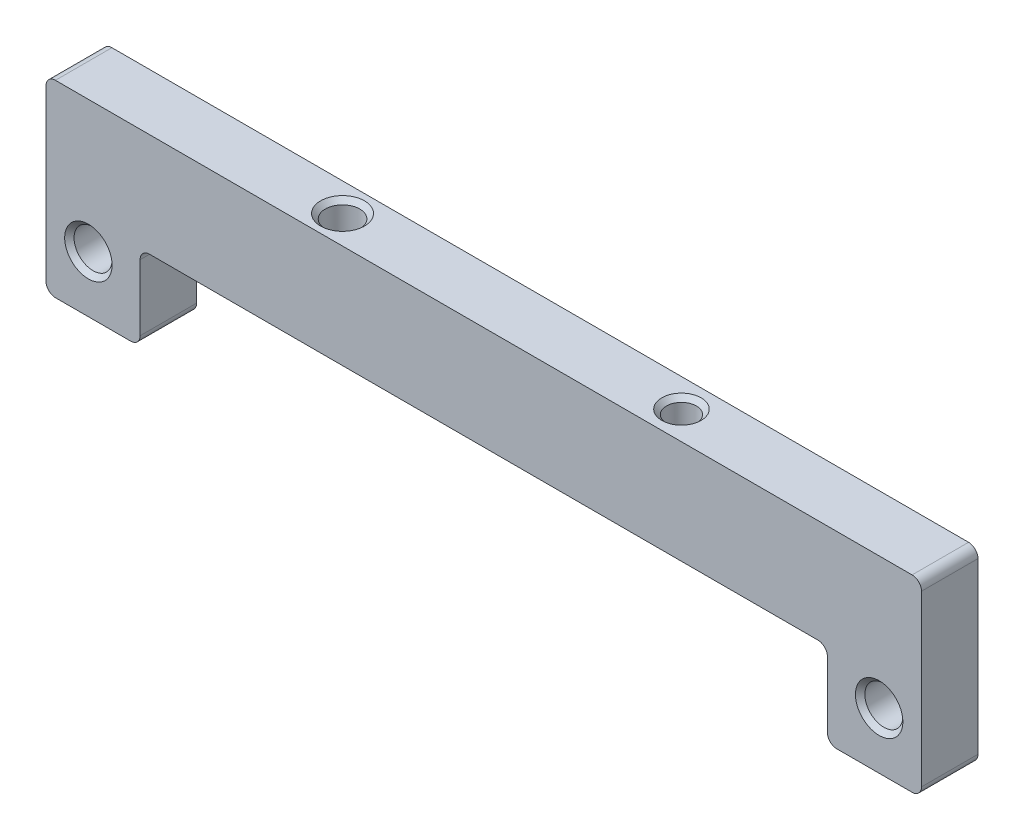
from build123d import *

# Parameters (mm, degrees)
SKETCH1_W                    = 93
SKETCH1_H                    = 20
BOSS_EXTRUDE1_DEPTH          = 6
CUT_EXTRUDE2_REACH           = 49.94
SKETCH3_W                    = 73
SKETCH3_H                    = 9
F_6_CLEARANCE_HOLE1_D        = 3.6576
TAP_DRILL_FOR_10_32_TAP1_D   = 4.0386
F_1_8_0_125_DIAMETER_HOLE1_D = 3.175
FILLET1_R                    = 1
CHAMFER2_SIZE                = 0.5


with BuildPart() as part:
    # Sketch1 → Boss-Extrude1 (new body)
    with BuildSketch(Plane.XY):
        Rectangle(SKETCH1_W, SKETCH1_H)
    extrude(amount=BOSS_EXTRUDE1_DEPTH)

    # Sketch3 → Cut-Extrude2 (cut, up to next)
    with BuildSketch(Plane.XY.offset(6), mode=Mode.PRIVATE) as cut_extrude2_sk1:
        with Locations((0, -5.5)):
            Rectangle(SKETCH3_W, SKETCH3_H)
    cut_extrude2_tool1 = extrude(cut_extrude2_sk1.sketch, amount=-CUT_EXTRUDE2_REACH, mode=Mode.PRIVATE) & part.part
    add(cut_extrude2_tool1.solids().sort_by_distance((0, -5.5, 6))[0], mode=Mode.SUBTRACT)

    # #6 Clearance Hole1 (through all)
    with Locations(Plane(origin=(0, -1, 0), x_dir=(-1, 0, 0), z_dir=(0, -1, 0))):
        with Locations((18, -3)):
            Hole(F_6_CLEARANCE_HOLE1_D / 2)

    # Tap Drill for #10-32 Tap1 (through all)
    with Locations(Plane.XY.offset(6)):
        with Locations((-42, -4), (42, -4)):
            Hole(TAP_DRILL_FOR_10_32_TAP1_D / 2)

    # 1/8 (0.125) Diameter Hole1 (through all)
    with Locations(Plane(origin=(0, -1, 0), x_dir=(-1, 0, 0), z_dir=(0, -1, 0))):
        with Locations((-18, -3)):
            Hole(F_1_8_0_125_DIAMETER_HOLE1_D / 2)

    # Fillet1
    fillet1_edges = [part.edges().sort_by_distance(p)[0] for p in [
        (-36.5, -10, 3),
        (-36.5, -1, 3),
        (36.5, -1, 3),
        (36.5, -10, 3),
        (46.5, -10, 3),
        (-46.5, -10, 3),
        (-46.5, 10, 3),
        (46.5, 10, 3),
    ]]
    fillet(fillet1_edges, radius=FILLET1_R)

    # Chamfer2
    chamfer2_edges = [part.edges().sort_by_distance(p)[0] for p in [
        (-19.8288, -1, 3),
        (-19.8288, 10, 3),
        (44.0193, -4, 6),
        (44.0193, -4, 0),
        (-39.9807, -4, 6),
        (-39.9807, -4, 0),
        (16.4125, -1, 3),
        (16.4125, 10, 3),
    ]]
    chamfer(chamfer2_edges, length=CHAMFER2_SIZE)


solid = part.part
